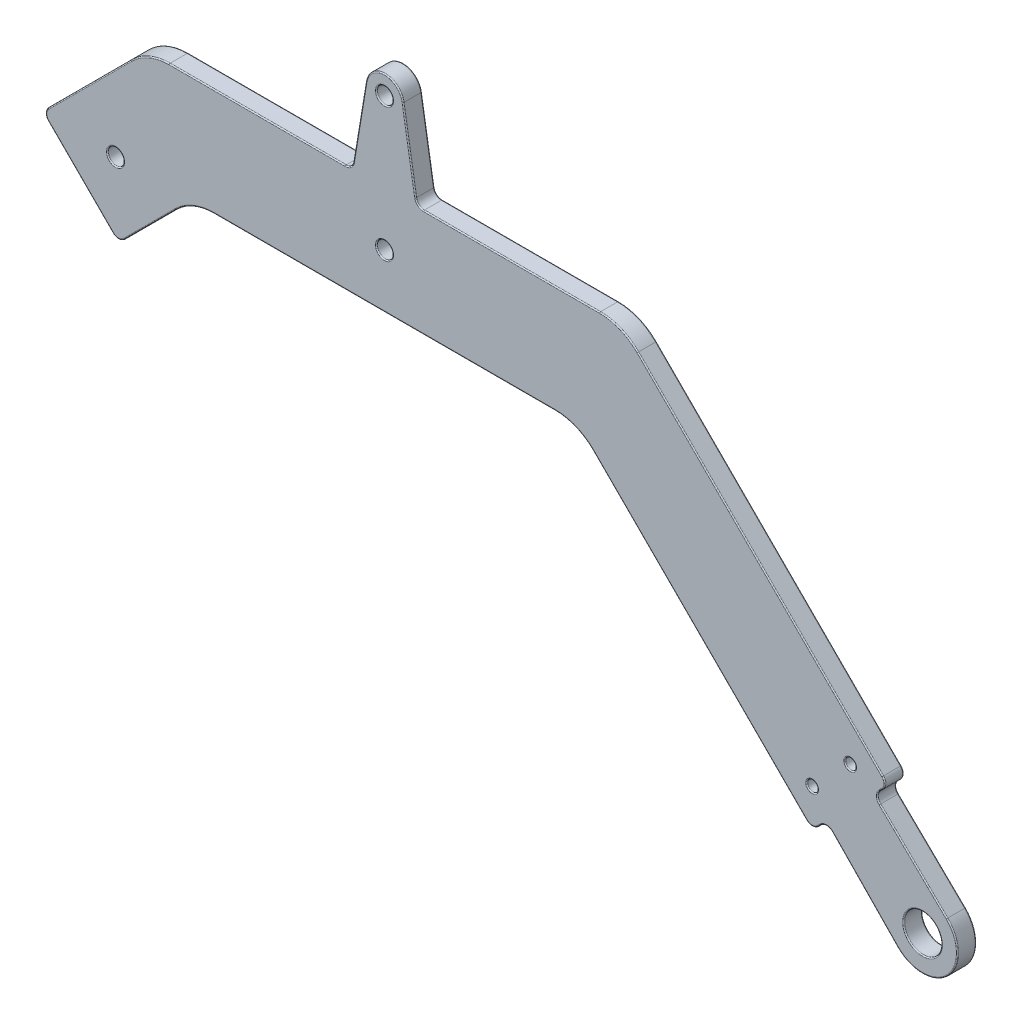
from build123d import *

# Parameters (mm, degrees)
SKETCH5_R           = 1
SKETCH5_R_2         = 3.5
SKETCH5_R_3         = 1.5
BOSS_EXTRUDE1_DEPTH = 3.5
FILLET1_R           = 10
FILLET2_R           = 1.5
FILLET3_R           = 0.2


with BuildPart() as part:
    # Sketch5 → Boss-Extrude1 (new body)
    with BuildSketch(Plane.XY):
        with BuildLine():
            Line((82.149090724, 9.019148409), (95.342398812, -4.533955357))
            ThreePointArc((95.342398812, -4.533955357), (104.596194078, -4.596194078), (104.533955357, 4.657601188))
            Line((104.533955357, 4.657601188), (90.980851591, 17.850909276))
            Line((90.980851591, 17.850909276), (93.636038969, 20.506096654))
            Line((93.636038969, 20.506096654), (44.142135624, 70))
            Line((44.142135624, 70), (6, 70))
            Line((6, 70), (3.453220204, 85.420324662))
            ThreePointArc((3.453220204, 85.420324662), (0, 88.35), (-3.453220204, 85.420324662))
            Line((-3.453220204, 85.420324662), (-6, 70))
            Line((-6, 70), (-44.142135624, 70))
            Line((-44.142135624, 70), (-63.587572106, 50.554563517))
            Line((-63.587572106, 50.554563517), (-49.445436483, 36.412427894))
            Line((-49.445436483, 36.412427894), (-35.857864376, 50))
            Line((-35.857864376, 50), (35.857864376, 50))
            Line((35.857864376, 50), (79.493903346, 6.363961031))
            Line((79.493903346, 6.363961031), (82.149090724, 9.019148409))
        make_face()
        with Locations((86.564971157, 20.506096654)):
            Circle(SKETCH5_R, mode=Mode.SUBTRACT)
        with Locations((100, 0)):
            Circle(SKETCH5_R_2, mode=Mode.SUBTRACT)
        with Locations((0, 84.85)):
            Circle(SKETCH5_R_3, mode=Mode.SUBTRACT)
        with Locations((0, 60)):
            Circle(SKETCH5_R_3, mode=Mode.SUBTRACT)
        with Locations((79.493903346, 13.435028843)):
            Circle(SKETCH5_R, mode=Mode.SUBTRACT)
        with Locations((-50, 50)):
            Circle(SKETCH5_R_3, mode=Mode.SUBTRACT)
    extrude(amount=BOSS_EXTRUDE1_DEPTH)

    # Fillet1
    fillet1_edges = [part.edges().sort_by_distance(p)[0] for p in [
        (35.857864376, 50, 1.75),
        (-35.857864376, 50, 1.75),
        (-44.142135624, 70, 1.75),
        (44.142135624, 70, 1.75),
    ]]
    fillet(fillet1_edges, radius=FILLET1_R)

    # Fillet2
    fillet2_edges = [part.edges().sort_by_distance(p)[0] for p in [
        (90.980851591, 17.850909276, 1.75),
        (82.149090724, 9.019148409, 1.75),
        (79.493903346, 6.363961031, 1.75),
        (-49.445436483, 36.412427894, 1.75),
        (-63.587572106, 50.554563517, 1.75),
        (-6, 70, 1.75),
        (6, 70, 1.75),
        (93.636038969, 20.506096654, 1.75),
    ]]
    fillet(fillet2_edges, radius=FILLET2_R)

    # Fillet3
    fillet3_edges = [part.edges().sort_by_distance(p)[0] for p in [
        (-56.516504294, 43.483495706, 0),
        (93.014718626, 20.506096654, 0),
        (79.493903346, 6.985281374, 0),
        (-62.966251763, 50.554563517, 0),
        (-49.445436483, 37.033748237, 0),
        (-56.516504294, 43.483495706, 3.5),
        (-23.636292033, 70, 3.5),
        (80.814314994, 7.684372679, 3.5),
        (89.275978249, 1.697903009, 3.5),
        (92.315627321, 19.185685006, 3.5),
        (69.823223305, 44.318912319, 3.5),
        (4.622926377, 78.337949903, 3.5),
        (93.014718626, 20.506096654, 3.5),
        (79.493903346, 6.985281374, 3.5),
        (-62.966251763, 50.554563517, 3.5),
        (-49.445436483, 37.033748237, 3.5),
        (-6.302181387, 70.356182427, 0),
        (-6.302181387, 70.356182427, 3.5),
        (6.302181387, 70.356182427, 0),
        (6.302181387, 70.356182427, 3.5),
        (82.144815041, 8.383430059, 0),
        (82.144815041, 8.383430059, 3.5),
        (91.616569941, 17.855184959, 0),
        (91.616569941, 17.855184959, 3.5),
        (98.302096991, 10.724021751, 0),
        (104.596194078, -4.596194078, 0),
        (-4.622926377, 78.337949903, 0),
        (0, 88.35, 0),
        (0, 88.35, 3.5),
        (-4.622926377, 78.337949903, 3.5),
        (85.564971157, 20.506096654, 0),
        (85.564971157, 20.506096654, 3.5),
        (96.5, 0, 0),
        (96.5, 0, 3.5),
        (-1.5, 84.85, 0),
        (-1.5, 84.85, 3.5),
        (-1.5, 60, 0),
        (-1.5, 60, 3.5),
        (78.493903346, 13.435028843, 0),
        (78.493903346, 13.435028843, 3.5),
        (-51.5, 50, 0),
        (-51.5, 50, 3.5),
        (104.596194078, -4.596194078, 3.5),
        (98.302096991, 10.724021751, 3.5),
        (0, 50, 0),
        (0, 50, 3.5),
        (58.610019869, 27.247844507, 0),
        (58.610019869, 27.247844507, 3.5),
        (-54.798989873, 59.343145751, 0),
        (-54.798989873, 59.343145751, 3.5),
        (23.636292033, 70, 0),
        (43.826834324, 69.238795325, 0),
        (-43.826834324, 69.238795325, 0),
        (23.636292033, 70, 3.5),
        (43.826834324, 69.238795325, 3.5),
        (-43.826834324, 69.238795325, 3.5),
        (-35.542563076, 49.238795325, 0),
        (-35.542563076, 49.238795325, 3.5),
        (35.542563076, 49.238795325, 0),
        (35.542563076, 49.238795325, 3.5),
        (-43.585786438, 42.272077939, 0),
        (-43.585786438, 42.272077939, 3.5),
        (-23.636292033, 70, 0),
        (4.622926377, 78.337949903, 0),
        (69.823223305, 44.318912319, 0),
        (92.315627321, 19.185685006, 0),
        (89.275978249, 1.697903009, 0),
        (80.814314994, 7.684372679, 0),
    ]]
    fillet(fillet3_edges, radius=FILLET3_R)


solid = part.part
